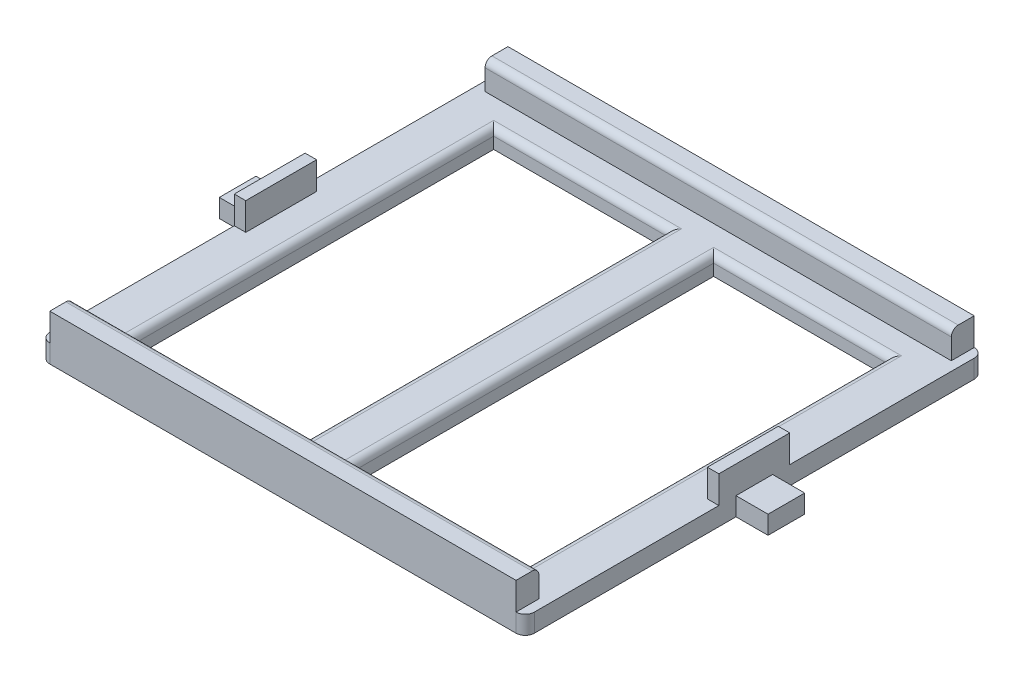
from build123d import *

# Parameters (mm, degrees)
CROQUIS1_W              = 19
CROQUIS1_H              = 40
SALIENTE_EXTRUIR1_DEPTH = 2
REDONDEO1_R             = 1
CROQUIS2_W              = 50.88
CROQUIS2_H              = 2.5
CROQUIS2_W_2            = 1.25
CROQUIS2_H_2            = 7.733481074
SALIENTE_EXTRUIR2_DEPTH = 3
REDONDEO2_R             = 0.75


with BuildPart() as part:
    # Croquis1 → Saliente-Extruir1 (new body)
    with BuildSketch(Plane(origin=(0, 0, 0), x_dir=(1, 0, 0), z_dir=(0, 1, 0))):
        Polygon((26.44, -25), (-26.44, -25), (-26.44, -2), (-29.94, -2), (-29.94, 2), (-26.44, 2), (-26.44, 25), (26.44, 25), (26.44, 2), (29.94, 2), (29.94, -2), (26.44, -2), align=None)
        with Locations((12, -0.5)):
            Rectangle(CROQUIS1_W, CROQUIS1_H, mode=Mode.SUBTRACT)
        with Locations((-12, -0.5)):
            Rectangle(CROQUIS1_W, CROQUIS1_H, mode=Mode.SUBTRACT)
    extrude(amount=SALIENTE_EXTRUIR1_DEPTH)

    # Redondeo1
    redondeo1_edges = [part.edges().sort_by_distance(p)[0] for p in [
        (-26.44, 1, -25),
        (26.44, 1, -25),
        (26.44, 1, 25),
        (-26.44, 1, 25),
    ]]
    fillet(redondeo1_edges, radius=REDONDEO1_R)

    # Croquis2 → Saliente-Extruir2 (add)
    with BuildSketch(Plane(origin=(0, 2, 0), x_dir=(1, 0, 0), z_dir=(0, 1, 0))):
        with Locations((0, 23.75)):
            Rectangle(CROQUIS2_W, CROQUIS2_H)
        with Locations((0, -23.75)):
            Rectangle(CROQUIS2_W, CROQUIS2_H)
        with Locations((-25.815, 0)):
            Rectangle(CROQUIS2_W_2, CROQUIS2_H_2)
        with Locations((25.815, 0)):
            Rectangle(CROQUIS2_W_2, CROQUIS2_H_2)
    extrude(amount=SALIENTE_EXTRUIR2_DEPTH)

    # Redondeo2
    redondeo2_edges = [part.edges().sort_by_distance(p)[0] for p in [
        (0, 5, 22.5),
        (-2.5, 2, 0.5),
        (-12, 2, -19.5),
        (-21.5, 2, 0.5),
        (-12, 2, 20.5),
        (12, 2, 20.5),
        (21.5, 2, 0.5),
        (12, 2, -19.5),
        (2.5, 2, 0.5),
        (0, 5, -22.5),
    ]]
    fillet(redondeo2_edges, radius=REDONDEO2_R)


solid = part.part
